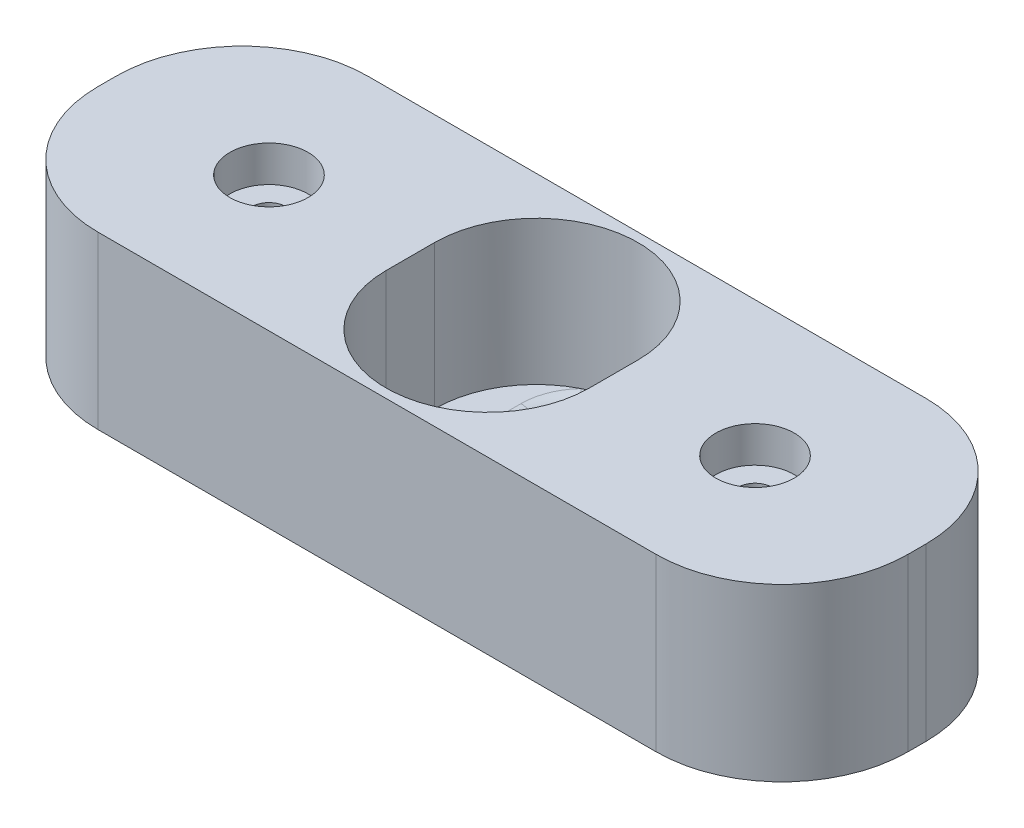
from build123d import *

# Parameters (mm, degrees)
SKETCH1_W           = 45
SKETCH1_H           = 15
BOSS_EXTRUDE1_DEPTH = 9.5
SKETCH2_R           = 5.5
CUT_EXTRUDE1_DEPTH  = 8
CUT_EXTRUDE6_DEPTH  = 8
CUT_EXTRUDE2_REACH  = 50.104
SKETCH4_R           = 2.175
CUT_EXTRUDE3_DEPTH  = 2
FILLET1_R           = 7
SKETCH5_R           = 2.05
CUT_EXTRUDE4_DEPTH  = 5
SKETCH6_R           = 0.95
CUT_EXTRUDE5_DEPTH  = 3
FILLET3_R           = 1


with BuildPart() as part:
    # Sketch1 → Boss-Extrude1 (new body)
    with BuildSketch(Plane(origin=(0, 0, 0), x_dir=(1, 0, 0), z_dir=(0, 1, 0))):
        with Locations((22.5, 7.5)):
            Rectangle(SKETCH1_W, SKETCH1_H)
    extrude(amount=-BOSS_EXTRUDE1_DEPTH)

    # Sketch2 → Cut-Extrude1 (cut)
    with BuildSketch(Plane(origin=(0, 0, 0), x_dir=(1, 0, 0), z_dir=(0, 1, 0))):
        with Locations(Location((22.5, 8.82, 0), (0, 0, 270))):
            Circle(SKETCH2_R)
    extrude(amount=-CUT_EXTRUDE1_DEPTH, mode=Mode.SUBTRACT)

    # Sketch8 → Cut-Extrude6 (cut)
    with BuildSketch(Plane(origin=(0, 0, 0), x_dir=(1, 0, 0), z_dir=(0, 1, 0))):
        with BuildLine():
            Line((16.85, 8.85), (16.85, 6.15))
            ThreePointArc((16.85, 6.15), (22.5, 0.5), (28.15, 6.15))
            Line((28.15, 6.15), (28.15, 8.85))
            ThreePointArc((28.15, 8.85), (22.5, 14.5), (16.85, 8.85))
        make_face()
    extrude(amount=-CUT_EXTRUDE6_DEPTH, mode=Mode.SUBTRACT)

    # Sketch3 → Cut-Extrude2 (cut, up to next)
    with BuildSketch(Plane(origin=(0, -8, 0), x_dir=(1, 0, 0), z_dir=(0, 1, 0)), mode=Mode.PRIVATE) as cut_extrude2_sk1:
        with BuildLine():
            Line((20, 11.5), (20, 3.5))
            ThreePointArc((20, 3.5), (22.5, 1), (25, 3.5))
            Line((25, 3.5), (25, 11.5))
            ThreePointArc((25, 11.5), (22.5, 14), (20, 11.5))
        make_face()
    cut_extrude2_tool1 = extrude(cut_extrude2_sk1.sketch, amount=-CUT_EXTRUDE2_REACH, mode=Mode.PRIVATE) & part.part
    add(cut_extrude2_tool1.solids().sort_by_distance((22.5, -8, -7.5))[0], mode=Mode.SUBTRACT)

    # Sketch4 → Cut-Extrude3 (cut)
    with BuildSketch(Plane(origin=(0, 0, 0), x_dir=(1, 0, 0), z_dir=(0, 1, 0))):
        with Locations(Location((9, 7.5, 0), (0, 0, 270))):
            Circle(SKETCH4_R)
        with Locations(Location((36, 7.5, 0), (0, 0, 270))):
            Circle(SKETCH4_R)
    extrude(amount=-CUT_EXTRUDE3_DEPTH, mode=Mode.SUBTRACT)

    # Fillet1
    fillet1_edges = [part.edges().sort_by_distance(p)[0] for p in [
        (0, -4.75, -15),
        (45, -4.75, -15),
        (45, -4.75, 0),
        (0, -4.75, 0),
    ]]
    fillet(fillet1_edges, radius=FILLET1_R)

    # Sketch5 → Cut-Extrude4 (cut)
    with BuildSketch(Plane(origin=(0, -9.5, 0), x_dir=(-1, 0, 0), z_dir=(0, -1, 0))):
        with Locations(Location((-36, 7.5, 0), (0, 0, 90))):
            Circle(SKETCH5_R)
        with Locations(Location((-9, 7.5, 0), (0, 0, 90))):
            Circle(SKETCH5_R)
    extrude(amount=-CUT_EXTRUDE4_DEPTH, mode=Mode.SUBTRACT)

    # Sketch6 → Cut-Extrude5 (cut)
    with BuildSketch(Plane(origin=(0, -2, 0), x_dir=(1, 0, 0), z_dir=(0, 1, 0))):
        with Locations(Location((9, 7.5, 0), (0, 0, 270))):
            Circle(SKETCH6_R)
        with Locations(Location((36, 7.5, 0), (0, 0, 270))):
            Circle(SKETCH6_R)
    extrude(amount=-CUT_EXTRUDE5_DEPTH, mode=Mode.SUBTRACT)

    # Fillet3
    fillet3_edges = [part.edges().sort_by_distance(p)[0] for p in [
        (22.5, -8, -14),
        (20, -8, -7.5),
        (22.5, -8, -1),
        (25, -8, -7.5),
    ]]
    fillet(fillet3_edges, radius=FILLET3_R)


solid = part.part
